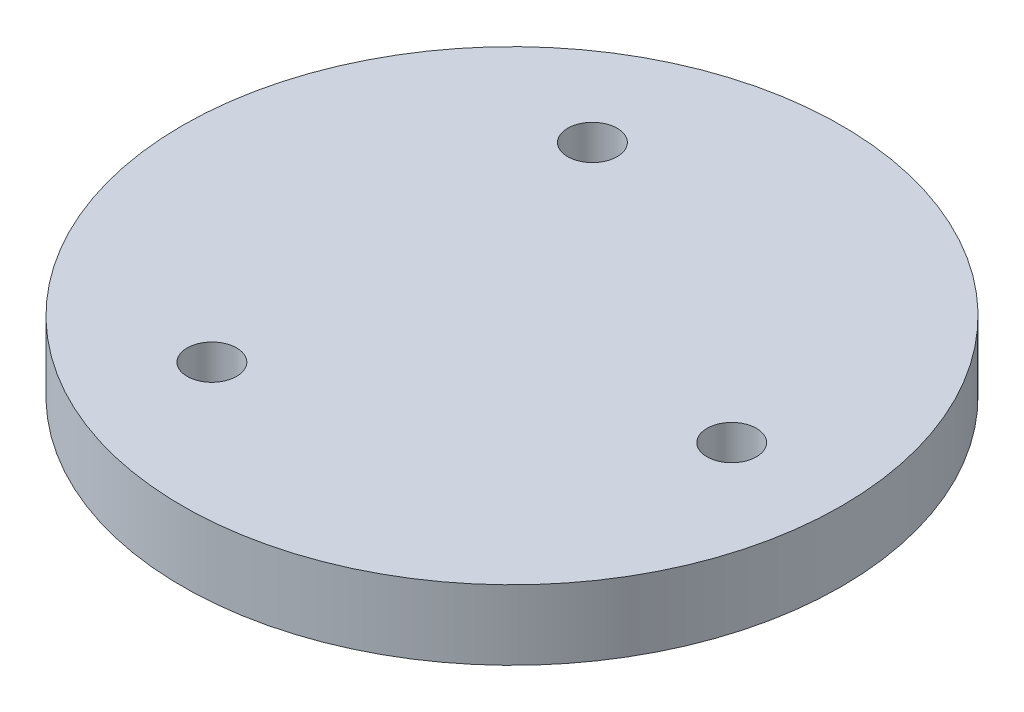
from build123d import *

# Parameters (mm, degrees)
SKETCH1_W                = 30
SKETCH1_H                = 6.35
M4_CLEARANCE_HOLE1_D     = 4.5
M4_CLEARANCE_HOLE1_DEPTH = 10.1
M4_CLEARANCE_HOLE1_TIP   = 1.351936393


with BuildPart() as part:
    # Sketch1 → Revolve1 (revolve)
    with BuildSketch(Plane.XY, mode=Mode.PRIVATE) as revolve1_sk:
        with Locations((-15, 0)):
            Rectangle(SKETCH1_W, SKETCH1_H)
    revolve(revolve1_sk.sketch.rotate(Axis((0, -3.175, 0), (0, 1, 0)), 180), axis=Axis((0, -3.175, 0), (0, 1, 0)))

    # M4 Clearance Hole1
    with Locations(Plane(origin=(0, -3.175, 0), x_dir=(-1, 0, 0), z_dir=(0, -1, 0))):
        with Locations((-20, 0), (10, -17.320508076), (10, 17.320508076)):
            Hole(M4_CLEARANCE_HOLE1_D / 2, depth=M4_CLEARANCE_HOLE1_DEPTH)
            with Locations((0, 0, -(M4_CLEARANCE_HOLE1_DEPTH + M4_CLEARANCE_HOLE1_TIP / 2))):  # 118° drill point
                Cone(0, M4_CLEARANCE_HOLE1_D / 2, M4_CLEARANCE_HOLE1_TIP, mode=Mode.SUBTRACT)


solid = part.part
